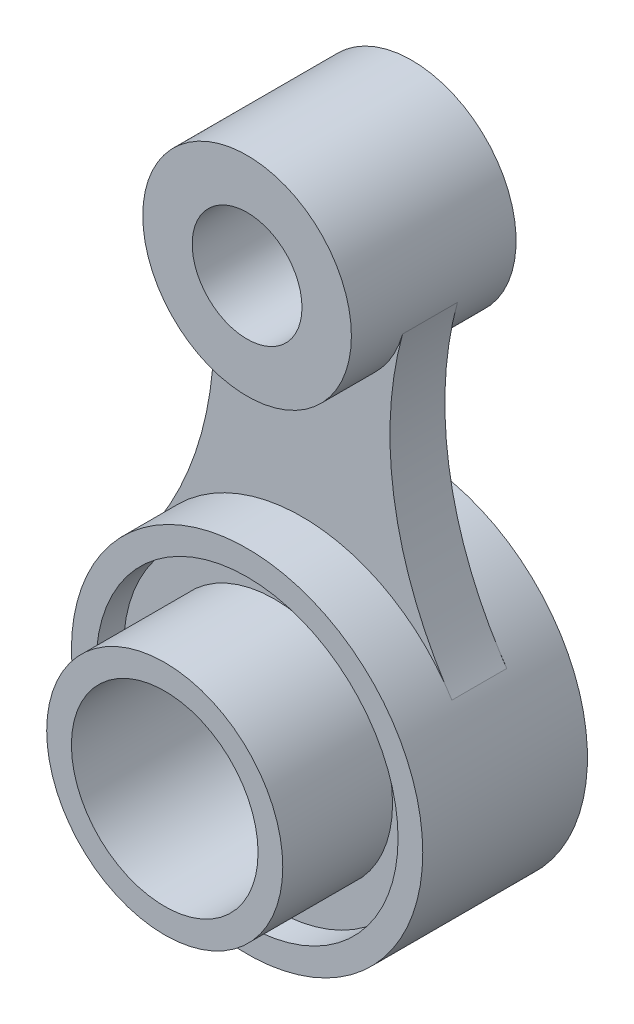
from build123d import *
from build123d.topology import SkipClean

# Parameters (mm, degrees)
BOSS_EXTRU_7_DEPTH       = 10
BOSS_EXTRU_13_START      = 10
ESQUISSE14_R             = 19
ESQUISSE14_R_2           = 32
BOSS_EXTRU_13_DEPTH      = 10
ESQUISSE15_R             = 19
BOSS_EXTRU_14_DEPTH      = 10
ESQUISSE16_R             = 32
BOSS_EXTRU_16_DEPTH      = 10
ESQUISSE21_R             = 27.5
ENL_V_MAT_EXTRU_10_DEPTH = 5
ESQUISSE25_R             = 21.5
BOSS_EXTRU_18_DEPTH      = 20
ESQUISSE26_R             = 17
ENL_V_MAT_EXTRU_11_DEPTH = 45
ESQUISSE27_R             = 10
ENL_V_MAT_EXTRU_12_DEPTH = 45


with BuildPart() as part:
    # Esquisse3 → Boss.-Extru.7 (new body)
    with BuildSketch(Plane.XY):
        with BuildLine():
            ThreePointArc((18.31877748, -5.042062242), (0, 19), (-18.31877748, -5.042062242))
            ThreePointArc((-18.31877748, -5.042062242), (-16.914599812, -32.664779147), (-27.297024291, -58.300525012))
            ThreePointArc((-27.297024291, -58.300525012), (0, -107), (27.297024291, -58.300525012))
            ThreePointArc((27.297024291, -58.300525012), (16.914599812, -32.664779147), (18.31877748, -5.042062242))
        make_face()
    extrude(amount=BOSS_EXTRU_7_DEPTH)

    # Esquisse14 → Boss.-Extru.13 (add)
    with SkipClean():  # the faces are left unmerged after this step: merging them gives an invalid solid
        with BuildSketch(Plane(origin=(0, 0, 0), x_dir=(-1, 0, 0), z_dir=(0, 0, -1)).offset(BOSS_EXTRU_13_START)):
            Circle(ESQUISSE14_R)
            with Locations((0, -75)):
                Circle(ESQUISSE14_R_2)
        extrude(amount=-BOSS_EXTRU_13_DEPTH)

    # Esquisse15 → Boss.-Extru.14 (add)
    with SkipClean():  # the faces are left unmerged after this step: merging them gives an invalid solid
        with BuildSketch(Plane.XY.offset(10)):
            with Locations(Location((0, 0, 0), (0, 0, 180))):
                Circle(ESQUISSE15_R)
        extrude(amount=BOSS_EXTRU_14_DEPTH)

    # Esquisse16 → Boss.-Extru.16 (add)
    with SkipClean():  # the faces are left unmerged after this step: merging them gives an invalid solid
        with BuildSketch(Plane.XY.offset(10)):
            with Locations(Location((0, -75, 0), (0, 0, 180))):
                Circle(ESQUISSE16_R)
        extrude(amount=BOSS_EXTRU_16_DEPTH)

    # Esquisse21 → Enlèv. mat.-Extru.10 (cut)
    with SkipClean():  # the faces are left unmerged after this step: merging them gives an invalid solid
        with BuildSketch(Plane.XY.offset(20)):
            with Locations((0, -75)):
                Circle(ESQUISSE21_R)
        extrude(amount=-ENL_V_MAT_EXTRU_10_DEPTH, mode=Mode.SUBTRACT)

    # Esquisse25 → Boss.-Extru.18 (add)
    with SkipClean():  # the faces are left unmerged after this step: merging them gives an invalid solid
        with BuildSketch(Plane.XY.offset(15)):
            with Locations((0, -75)):
                Circle(ESQUISSE25_R)
        extrude(amount=BOSS_EXTRU_18_DEPTH)

    # Esquisse26 → Enlèv. mat.-Extru.11 (cut)
    with SkipClean():  # the faces are left unmerged after this step: merging them gives an invalid solid
        with BuildSketch(Plane.XY.offset(35)):
            with Locations((0, -75)):
                Circle(ESQUISSE26_R)
        extrude(amount=-ENL_V_MAT_EXTRU_11_DEPTH, mode=Mode.SUBTRACT)

    # Esquisse27 → Enlèv. mat.-Extru.12 (cut)
    with SkipClean():  # the faces are left unmerged after this step: merging them gives an invalid solid
        with BuildSketch(Plane.XY.offset(20)):
            Circle(ESQUISSE27_R)
        extrude(amount=-ENL_V_MAT_EXTRU_12_DEPTH, mode=Mode.SUBTRACT)


solid = part.part
